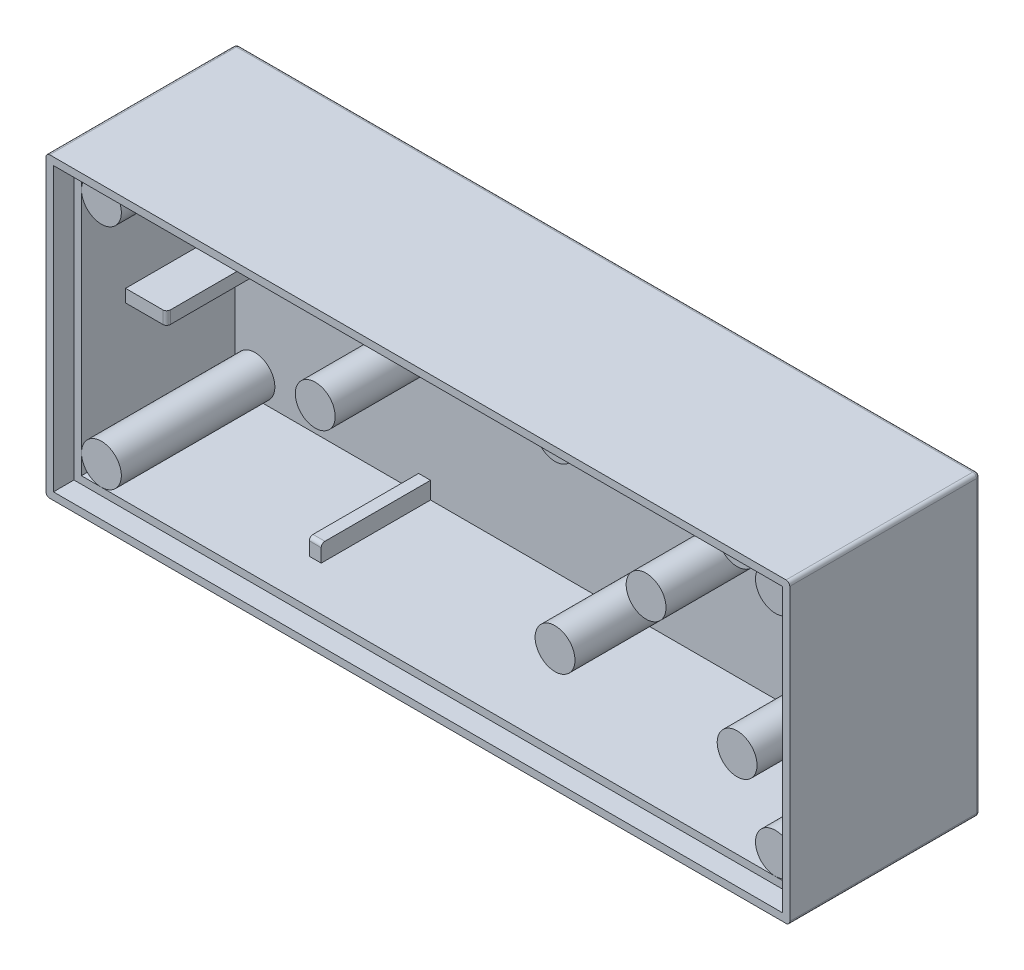
from build123d import *

# Parameters (mm, degrees)
IZIM1_W                     = 100
IZIM1_H                     = 40
Y_KSEKLIK_EKSTR_ZYON1_DEPTH = 25.6
IZIM2_W                     = 96
IZIM2_H                     = 36
KES_EKSTR_ZYON1_DEPTH       = 23.4
IZIM5_R                     = 2.68
Y_KSEKLIK_EKSTR_ZYON6_DEPTH = 22.42
IZIM6_W                     = 98
IZIM6_H                     = 38
KES_EKSTR_ZYON2_DEPTH       = 2.76
IZIM7_W                     = 5.52
IZIM7_H                     = 1.7
Y_KSEKLIK_EKSTR_ZYON7_DEPTH = 14.7
IZIM8_W                     = 1.6
IZIM8_H                     = 2.3
Y_KSEKLIK_EKSTR_ZYON8_DEPTH = 14.7
IZIM9_R                     = 2.68
Y_KSEKLIK_EKSTR_ZYON9_DEPTH = 14.7
RADYUS1_R                   = 0.5


with BuildPart() as part:
    # Çizim1 → Yükseklik-Ekstrüzyon1 (new body)
    with BuildSketch(Plane.XY):
        with Locations((7.815221761, -0.187165775)):
            Rectangle(IZIM1_W, IZIM1_H)
    extrude(amount=Y_KSEKLIK_EKSTR_ZYON1_DEPTH)

    # Çizim2 → Kes-Ekstrüzyon1 (cut)
    with BuildSketch(Plane.XY.offset(25.6)):
        with Locations((7.815221761, -0.187165775)):
            Rectangle(IZIM2_W, IZIM2_H)
    extrude(amount=-KES_EKSTR_ZYON1_DEPTH, mode=Mode.SUBTRACT)

    # Çizim5 → Yükseklik-Ekstrüzyon6 (add)
    with BuildSketch(Plane.XY.offset(2.2)):
        with Locations(Location((-37.494778239, 15.122834225, 0), (0, 0, 180))):
            Circle(IZIM5_R)
        with Locations(Location((-37.494778239, -15.497165775, 0), (0, 0, 180))):
            Circle(IZIM5_R)
        with Locations(Location((53.125221761, -15.497165775, 0), (0, 0, 180))):
            Circle(IZIM5_R)
        with Locations(Location((53.125221761, 15.122834225, 0), (0, 0, 180))):
            Circle(IZIM5_R)
    extrude(amount=Y_KSEKLIK_EKSTR_ZYON6_DEPTH)

    # Çizim6 → Kes-Ekstrüzyon2 (cut)
    with BuildSketch(Plane.XY.offset(25.6)):
        with Locations((7.815221761, -0.187165775)):
            Rectangle(IZIM6_W, IZIM6_H)
    extrude(amount=-KES_EKSTR_ZYON2_DEPTH, mode=Mode.SUBTRACT)

    # Çizim7 → Yükseklik-Ekstrüzyon7 (add)
    with BuildSketch(Plane.XY.offset(2.2)):
        with Locations((53.055221761, -0.187165775)):
            Rectangle(IZIM7_W, IZIM7_H)
        with Locations((-37.424778239, -0.187165775)):
            Rectangle(IZIM7_W, IZIM7_H)
    extrude(amount=Y_KSEKLIK_EKSTR_ZYON7_DEPTH)

    # Çizim8 → Yükseklik-Ekstrüzyon8 (add)
    with BuildSketch(Plane.XY.offset(2.2)):
        with Locations((-14.684778239, 16.662834225)):
            Rectangle(IZIM8_W, IZIM8_H)
        with Locations((-14.684778239, -17.037165775)):
            Rectangle(IZIM8_W, IZIM8_H)
    extrude(amount=Y_KSEKLIK_EKSTR_ZYON8_DEPTH)

    # Çizim9 → Yükseklik-Ekstrüzyon9 (add)
    with BuildSketch(Plane.XY.offset(2.2)):
        with Locations((42.035221761, 12.052834225)):
            Circle(IZIM9_R)
        with Locations(Location((42.035221761, -12.427165775, 0), (0, 0, 180))):
            Circle(IZIM9_R)
        with Locations((17.555221761, 12.052834225)):
            Circle(IZIM9_R)
        with Locations(Location((17.555221761, -12.427165775, 0), (0, 0, 180))):
            Circle(IZIM9_R)
        with Locations((29.795221761, -0.187165775)):
            Circle(IZIM9_R)
        with Locations((-14.684778239, -0.187165775)):
            Circle(IZIM9_R)
    extrude(amount=Y_KSEKLIK_EKSTR_ZYON9_DEPTH)

    # Radyus1
    radyus1_edges = [part.edges().sort_by_distance(p)[0] for p in [
        (-34.664778239, -0.187165775, 16.9),
        (-14.684778239, 15.512834225, 16.9),
        (-14.684778239, -15.887165775, 16.9),
        (7.815221761, 19.812834225, 0),
        (57.815221761, -0.187165775, 0),
        (7.815221761, -20.187165775, 0),
        (-42.184778239, -0.187165775, 0),
        (-42.184778239, 19.812834225, 12.8),
        (57.815221761, 19.812834225, 12.8),
        (57.815221761, -20.187165775, 12.8),
        (-42.184778239, -20.187165775, 12.8),
        (50.295221761, -0.187165775, 16.9),
    ]]
    fillet(radyus1_edges, radius=RADYUS1_R)


solid = part.part
